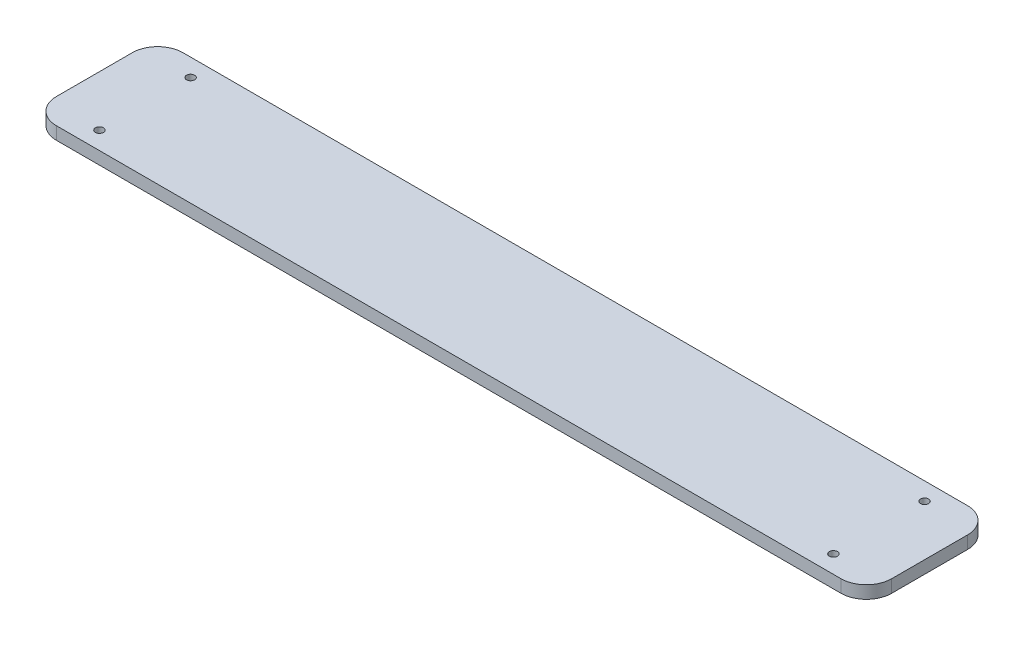
from build123d import *

# Parameters (mm, degrees)
SKETCH1_W           = 330
SKETCH1_H           = 50
SKETCH1_R           = 1.6
BOSS_EXTRUDE1_DEPTH = 5
FILLET1_R           = 10


with BuildPart() as part:
    # Sketch1 → Boss-Extrude1 (new body)
    with BuildSketch(Plane(origin=(0, 0, 0), x_dir=(1, 0, 0), z_dir=(0, 1, 0))):
        with Locations((165, 25)):
            Rectangle(SKETCH1_W, SKETCH1_H)
        with Locations(Location((20, 43, 0), (0, 0, 270))):
            Circle(SKETCH1_R, mode=Mode.SUBTRACT)
        with Locations(Location((20, 7, 0), (0, 0, 270))):
            Circle(SKETCH1_R, mode=Mode.SUBTRACT)
        with Locations(Location((310, 7, 0), (0, 0, 90))):
            Circle(SKETCH1_R, mode=Mode.SUBTRACT)
        with Locations(Location((310, 43, 0), (0, 0, 90))):
            Circle(SKETCH1_R, mode=Mode.SUBTRACT)
    extrude(amount=BOSS_EXTRUDE1_DEPTH)

    # Fillet1
    fillet1_edges = [part.edges().sort_by_distance(p)[0] for p in [
        (0, 2.5, -50),
        (330, 2.5, -50),
        (330, 2.5, 0),
        (0, 2.5, 0),
    ]]
    fillet(fillet1_edges, radius=FILLET1_R)


solid = part.part
